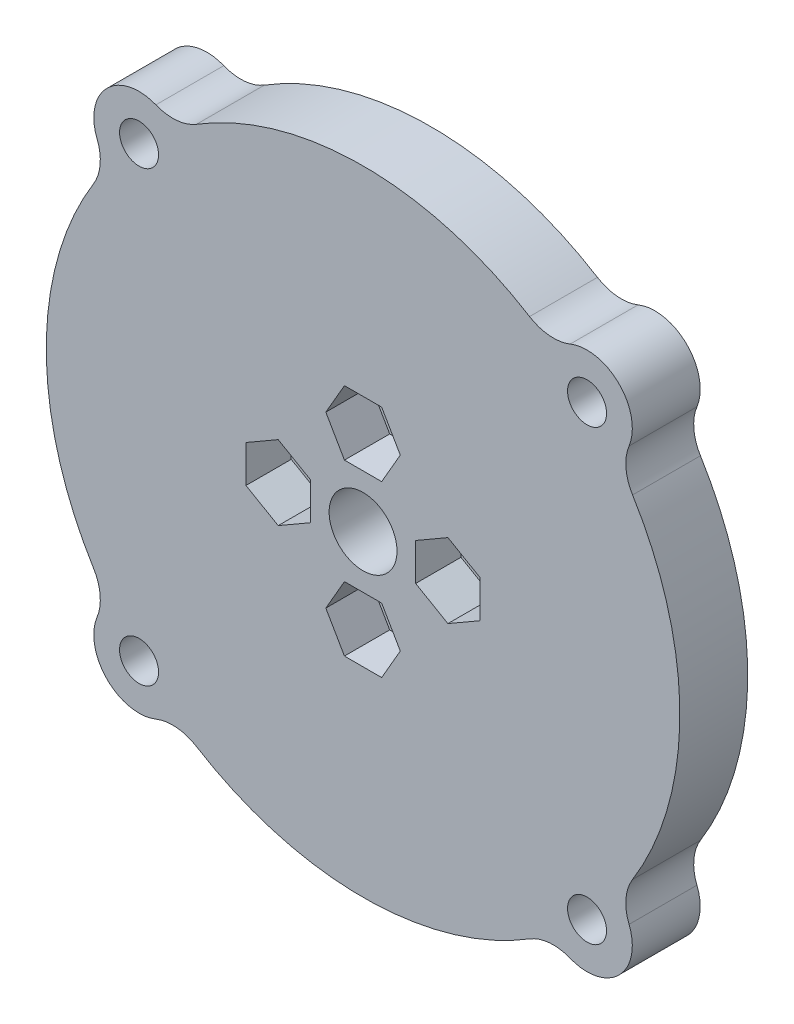
from build123d import *

# Parameters (mm, degrees)
SKETCH1_R           = 1.725
SKETCH1_R_2         = 3
BOSS_EXTRUDE3_DEPTH = 6
CUT_EXTRUDE1_DEPTH  = 4
FILLET1_R           = 4


with BuildPart() as part:
    # Sketch1 → Boss-Extrude3 (new body)
    with BuildSketch(Plane.XY):
        with BuildLine():
            ThreePointArc((22.418161887, -16.775756842), (28, 0), (22.418161887, 16.775756842))
            ThreePointArc((22.418161887, 16.775756842), (22.627416998, 22.627416998), (16.775756842, 22.418161887))
            ThreePointArc((16.775756842, 22.418161887), (0, 28), (-16.775756842, 22.418161887))
            ThreePointArc((-16.775756842, 22.418161887), (-22.627416998, 22.627416998), (-22.418161887, 16.775756842))
            ThreePointArc((-22.418161887, 16.775756842), (-28, 0), (-22.418161887, -16.775756842))
            ThreePointArc((-22.418161887, -16.775756842), (-22.627416998, -22.627416998), (-16.775756842, -22.418161887))
            ThreePointArc((-16.775756842, -22.418161887), (0, -28), (16.775756842, -22.418161887))
            ThreePointArc((16.775756842, -22.418161887), (22.627416998, -22.627416998), (22.418161887, -16.775756842))
        make_face()
        with Locations((-19.798989873, 19.798989873)):
            Circle(SKETCH1_R, mode=Mode.SUBTRACT)
        with Locations((19.798989873, 19.798989873)):
            Circle(SKETCH1_R, mode=Mode.SUBTRACT)
        with Locations((-19.798989873, -19.798989873)):
            Circle(SKETCH1_R, mode=Mode.SUBTRACT)
        with Locations((19.798989873, -19.798989873)):
            Circle(SKETCH1_R, mode=Mode.SUBTRACT)
        Circle(SKETCH1_R_2, mode=Mode.SUBTRACT)
        with Locations((0, 7.5)):
            Circle(SKETCH1_R, mode=Mode.SUBTRACT)
        with Locations((-7.5, 0)):
            Circle(SKETCH1_R, mode=Mode.SUBTRACT)
        with Locations((0, -7.5)):
            Circle(SKETCH1_R, mode=Mode.SUBTRACT)
        with Locations((7.5, 0)):
            Circle(SKETCH1_R, mode=Mode.SUBTRACT)
    extrude(amount=BOSS_EXTRUDE3_DEPTH)

    # Sketch2 → Cut-Extrude1 (cut)
    with BuildSketch(Plane.XY.offset(6)):
        Polygon((3.290896534, 7.5), (1.645448267, 10.35), (-1.645448267, 10.35), (-3.290896534, 7.5), (-1.645448267, 4.65), (1.645448267, 4.65), align=None)
        Polygon((-4.65, 1.645448267), (-7.5, 3.290896534), (-10.35, 1.645448267), (-10.35, -1.645448267), (-7.5, -3.290896534), (-4.65, -1.645448267), align=None)
        Polygon((10.35, -1.645448267), (10.35, 1.645448267), (7.5, 3.290896534), (4.65, 1.645448267), (4.65, -1.645448267), (7.5, -3.290896534), align=None)
        Polygon((3.290896534, -7.5), (1.645448267, -4.65), (-1.645448267, -4.65), (-3.290896534, -7.5), (-1.645448267, -10.35), (1.645448267, -10.35), align=None)
    extrude(amount=-CUT_EXTRUDE1_DEPTH, mode=Mode.SUBTRACT)

    # Fillet1
    fillet1_edges = [part.edges().sort_by_distance(p)[0] for p in [
        (22.418161887, -16.775756842, 3),
        (16.775756842, -22.418161887, 3),
        (-16.775756842, -22.418161887, 3),
        (-22.418161887, -16.775756842, 3),
        (-22.418161887, 16.775756842, 3),
        (-16.775756842, 22.418161887, 3),
        (16.775756842, 22.418161887, 3),
        (22.418161887, 16.775756842, 3),
    ]]
    fillet(fillet1_edges, radius=FILLET1_R)


solid = part.part
